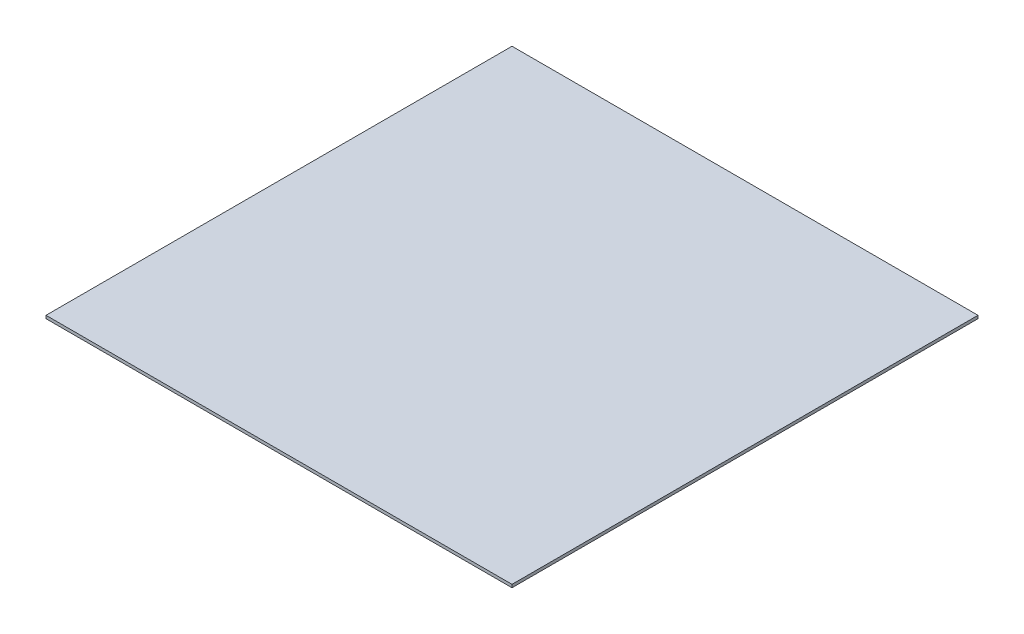
from build123d import *

# Parameters (mm, degrees)
SKETCH1_W           = 469.9
SKETCH1_H           = 469.9
BOSS_EXTRUDE1_DEPTH = 3


with BuildPart() as part:
    # Sketch1 → Boss-Extrude1 (new body)
    with BuildSketch(Plane(origin=(0, 0, 0), x_dir=(1, 0, 0), z_dir=(0, 1, 0))):
        with Locations((1413.302520006, 80.234262384)):
            Rectangle(SKETCH1_W, SKETCH1_H)
    extrude(amount=BOSS_EXTRUDE1_DEPTH)


solid = part.part
